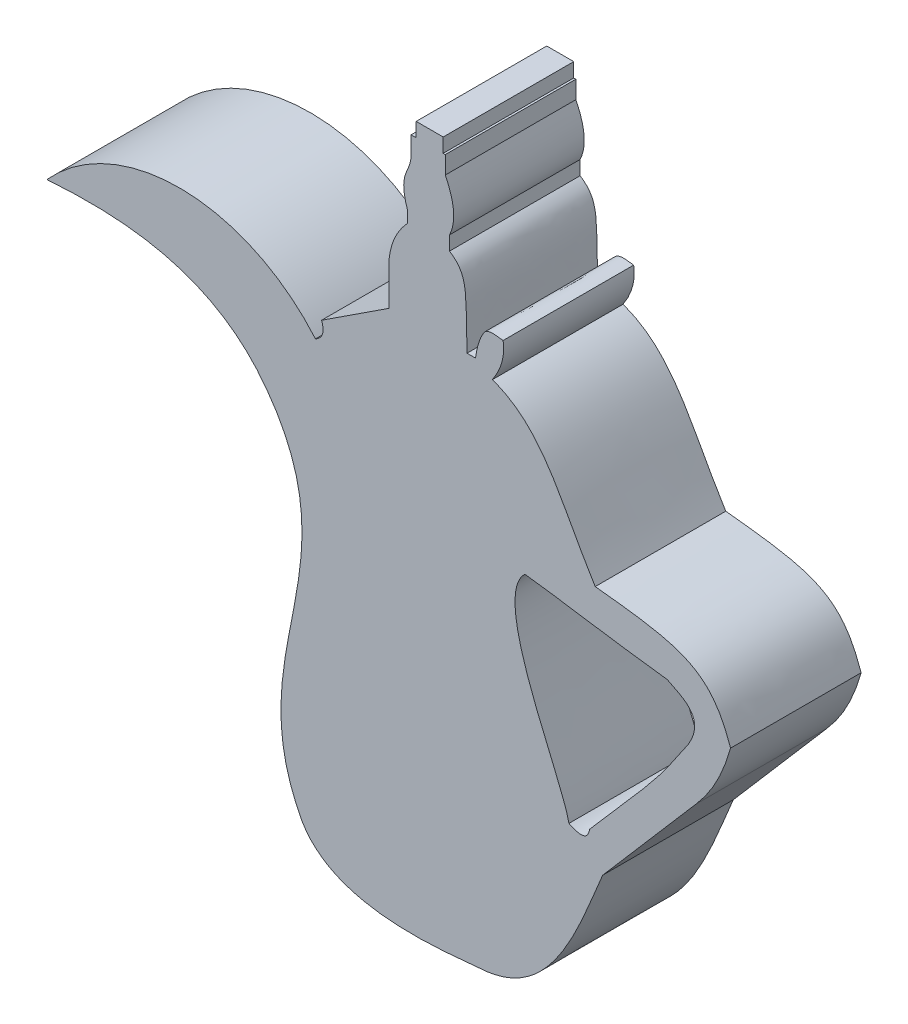
from build123d import *

# Parameters (mm, degrees)
BOSS_EXTRUDE1_DEPTH = 35


with BuildPart() as part:
    # Sketch3 → Boss-Extrude1 (new body)
    with BuildSketch(Plane.XY):
        with BuildLine():
            Line((104, 194), (111.243139856, 194))
            Line((111.243139856, 194), (111.243139856, 190.199930167))
            Line((111.243139856, 190.199930167), (111.809163479, 190.199930167))
            Line((111.809163479, 190.199930167), (111.809163479, 185.445331727))
            add(Edge.make_bspline(
                [(111.809163479, 185.445331727), (115.630666058, 177.738605975), (112.937296847, 172.1212629)],
                knots=[0, 0, 0, 1, 1, 1], degree=2))
            Line((112.937296847, 172.1212629), (112.937296847, 168.342339632))
            add(Edge.make_bspline(
                [(112.937296847, 168.342339632), (118.358048897, 164.899319212), (117.128849175, 160.233165907), (117.639910042, 147)],
                knots=[0, 0, 0, 0, 1, 1, 1, 1], degree=3))
            Line((117.639910042, 147), (119.90413121, 147))
            add(Edge.make_bspline(
                [(122.342523237, 154.28785602), (120.569137325, 151.788044026), (119.90413121, 147)],
                knots=[0, 0, 0, 1, 1, 1], degree=2))
            add(Edge.make_bspline(
                [(127.30639272, 154.791262423), (124.631060475, 155.158386188), (123.403223541, 155.246203552), (122.342523237, 154.28785602)],
                knots=[0, 0, 0, 0, 1, 1, 1, 1], degree=3))
            add(Edge.make_bspline(
                [(127.30639272, 154.791262423), (128.102460929, 149.696425885), (124.432573546, 144.253925449)],
                knots=[0, 0, 0, 1, 1, 1], degree=2))
            add(Edge.make_bspline(
                [(124.432573546, 144.253925449), (138.252698579, 139.373901468), (142.484561782, 125.111835366), (152, 110)],
                knots=[0, 0, 0, 0, 1, 1, 1, 1], degree=3))
            add(Edge.make_bspline(
                [(152, 110), (175.039355648, 107.553077396), (182.977740075, 106.047089354), (188.284323191, 90.640880306)],
                knots=[0, 0, 0, 0, 1, 1, 1, 1], degree=3))
            add(Edge.make_bspline(
                [(188.284323191, 90.640880306), (186.033057199, 82.636770575), (182.695601326, 77.159135199), (179, 73)],
                knots=[0, 0, 0, 0, 1, 1, 1, 1], degree=3))
            Line((179, 73), (154, 44))
            add(Edge.make_bspline(
                [(154, 44), (147.841709553, 29.630655625), (140.819991316, 7.536325822), (122, 6), (111.450923586, 5.138850905), (81.435635461, 0.597375492), (73, 17), (55.631232253, 50.772603952), (89.132205207, 79.401450448), (63, 113), (48.978668521, 131.027426187), (25.644025715, 132.474573265), (5, 131)],
                knots=[0, 0, 0, 0, 1, 1, 1, 2, 2, 2, 3, 3, 3, 4, 4, 4, 4], degree=3))
            ThreePointArc((5, 131), (41.227086047, 146.850195397), (77, 130))
            add(Edge.make_bspline(
                [(77, 130), (79.957617681, 131.632429648), (78.64070831, 135.155645603)],
                knots=[0, 0, 0, 1, 1, 1], degree=2))
            Line((78.64070831, 135.155645603), (96.780957221, 147))
            Line((96.780957221, 147), (96.780957221, 154.28785602))
            add(Edge.make_bspline(
                [(101.733942976, 169.257056086), (95.884306476, 162.901856833), (96.780957221, 154.28785602)],
                knots=[0, 0, 0, 1, 1, 1], degree=2))
            Line((101.733942976, 169.257056086), (101.733942976, 172.1212629))
            add(Edge.make_bspline(
                [(101.733942976, 172.1212629), (98.855887436, 180.424291339), (102.703814002, 181.080128123), (102.639580774, 185.671741176)],
                knots=[0, 0, 0, 0, 1, 1, 1, 1], degree=3))
            Line((102.639580774, 185.671741176), (102.639580774, 190.199930167))
            Line((102.639580774, 190.199930167), (104, 190.199930167))
            Line((104, 190.199930167), (104, 194))
        make_face()
        with BuildLine():
            add(Edge.make_bspline(
                [(133.158224266, 103.433700895), (123.525657378, 94.3515664), (143.03925437, 61.458156624), (144.95378688, 51.502587568)],
                knots=[0, 0, 0, 0, 1, 1, 1, 1], degree=3))
            add(Edge.make_bspline(
                [(144.95378688, 51.502587568), (149.946695483, 49.006133267), (150.468595375, 52.881289692)],
                knots=[0, 0, 0, 1, 1, 1], degree=2))
            add(Edge.make_bspline(
                [(175.132044477, 83.212736414), (168.093361695, 72.65471224), (166.361687612, 71.263661436), (150.468595375, 52.881289692)],
                knots=[0, 0, 0, 0, 1, 1, 1, 1], degree=3))
            add(Edge.make_bspline(
                [(171.302316356, 98.072081525), (175.258451909, 95.902587835), (183.273891979, 93.729289437), (175.132044477, 83.212736414)],
                knots=[0, 0, 0, 0, 1, 1, 1, 1], degree=3))
            add(Edge.make_bspline(
                [(133.158224266, 103.433700895), (145.794923439, 101.901979783), (150.585355412, 100.661701643), (171.302316356, 98.072081525)],
                knots=[0, 0, 0, 0, 1, 1, 1, 1], degree=3))
        make_face(mode=Mode.SUBTRACT)
    extrude(amount=BOSS_EXTRUDE1_DEPTH)


solid = part.part
